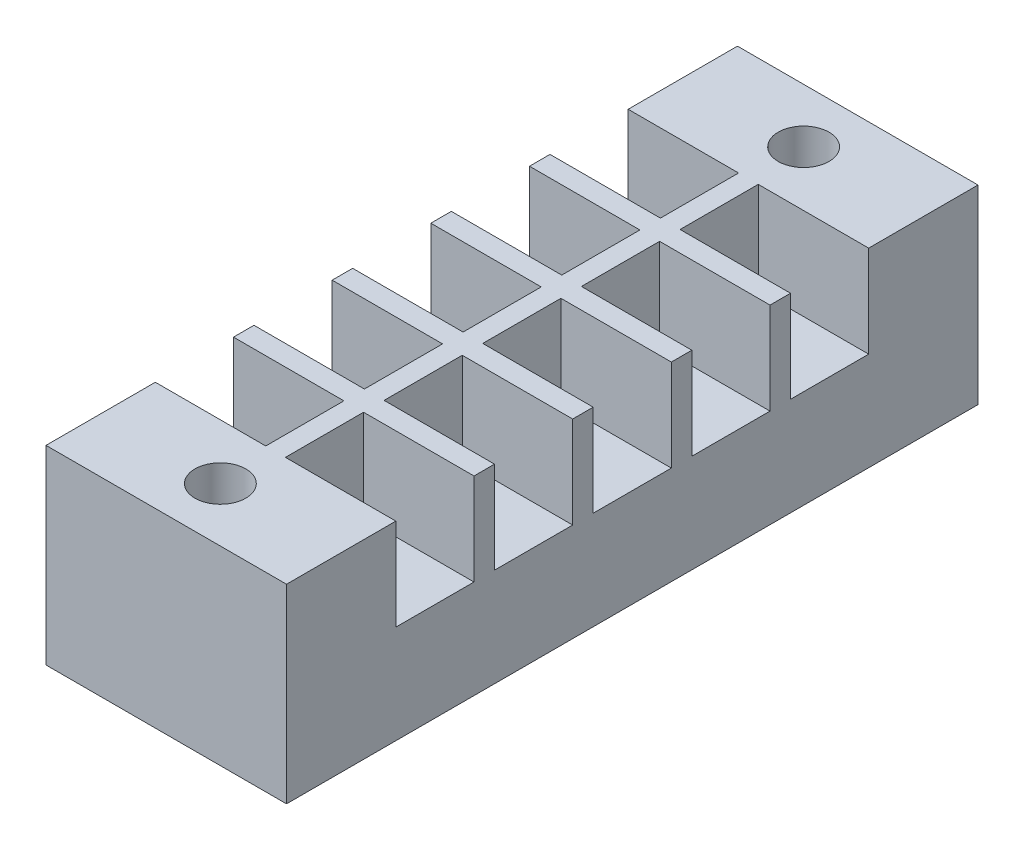
from build123d import *

# Parameters (mm, degrees)
SKETCH1_W           = 22
SKETCH1_H           = 63.25
BOSS_EXTRUDE1_DEPTH = 17.4
SKETCH2_W           = 10.1
SKETCH2_H           = 7.15
CUT_EXTRUDE1_DEPTH  = 8.4
SKETCH3_R           = 2.325
CUT_EXTRUDE2_DEPTH  = 38.734607789


with BuildPart() as part:
    # Sketch1 → Boss-Extrude1 (new body)
    with BuildSketch(Plane(origin=(0, 0, 0), x_dir=(1, 0, 0), z_dir=(0, 1, 0))):
        Rectangle(SKETCH1_W, SKETCH1_H)
    extrude(amount=BOSS_EXTRUDE1_DEPTH)

    # Sketch2 → Cut-Extrude1 (cut)
    with BuildSketch(Plane(origin=(0, 17.4, 0), x_dir=(1, 0, 0), z_dir=(0, 1, 0))):
        with Locations((-5.95, 18.05)):
            Rectangle(SKETCH2_W, SKETCH2_H)
        with Locations((5.95, 18.05)):
            Rectangle(SKETCH2_W, SKETCH2_H)
        with Locations((-5.95, 9.025)):
            Rectangle(SKETCH2_W, SKETCH2_H)
        with Locations((5.95, 9.025)):
            Rectangle(SKETCH2_W, SKETCH2_H)
        with Locations((-5.95, 0)):
            Rectangle(SKETCH2_W, SKETCH2_H)
        with Locations((5.95, 0)):
            Rectangle(SKETCH2_W, SKETCH2_H)
        with Locations((-5.95, -9.025)):
            Rectangle(SKETCH2_W, SKETCH2_H)
        with Locations((5.95, -9.025)):
            Rectangle(SKETCH2_W, SKETCH2_H)
        with Locations((-5.95, -18.05)):
            Rectangle(SKETCH2_W, SKETCH2_H)
        with Locations((5.95, -18.05)):
            Rectangle(SKETCH2_W, SKETCH2_H)
    extrude(amount=-CUT_EXTRUDE1_DEPTH, mode=Mode.SUBTRACT)

    # Sketch3 → Cut-Extrude2 (cut, through all)
    with BuildSketch(Plane(origin=(0, 0, 0), x_dir=(1, 0, 0), z_dir=(0, 1, 0))):
        with Locations(Location((0, 26.675, 0), (0, 0, 270))):
            Circle(SKETCH3_R)
        with Locations(Location((0, -26.675, 0), (0, 0, 270))):
            Circle(SKETCH3_R)
    extrude(amount=CUT_EXTRUDE2_DEPTH, mode=Mode.SUBTRACT)


solid = part.part
